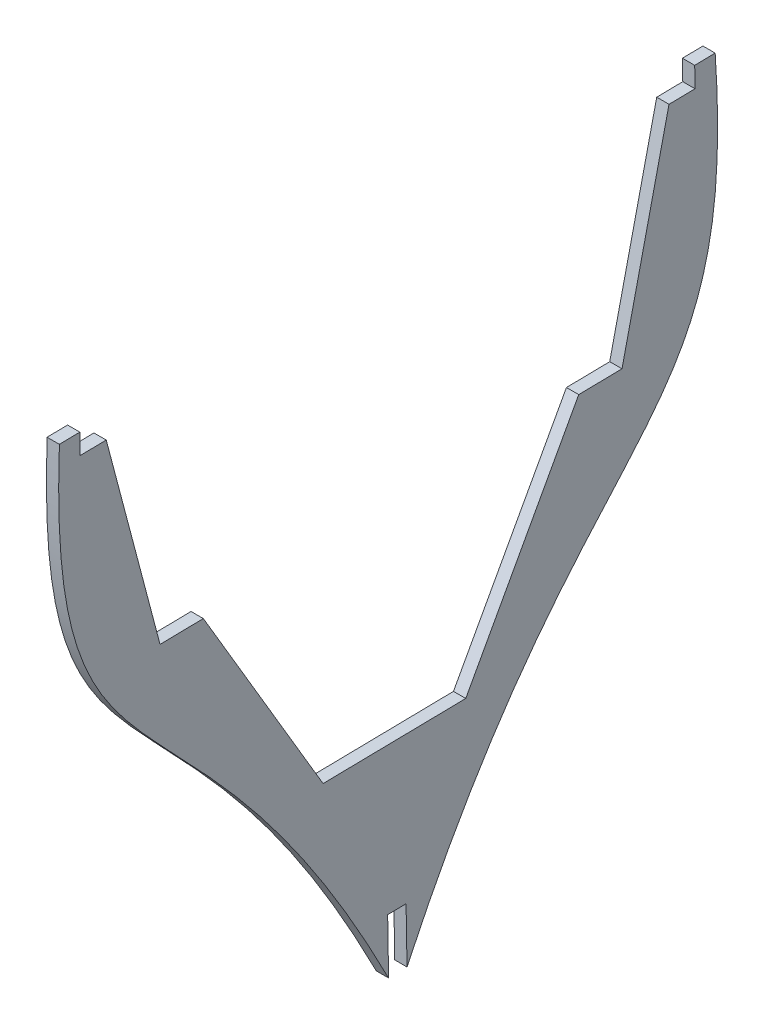
from build123d import *

# Parameters (mm, degrees)
BOSS_EXTRU_3_DEPTH      = 6
ENL_V_MAT_EXTRU_1_DEPTH = 6


with BuildPart() as part:
    # Esquisse2 → Boss.-Extru.3 (new body)
    with BuildSketch(Plane(origin=(0, 0, 0), x_dir=(0, 0, -1), z_dir=(1, 0, 0))):
        with BuildLine():
            Line((-166.024970345, 350.659764397), (-156.024970345, 350.826098218))
            Line((-156.024970345, 350.826098218), (-155.858636524, 340.826098218))
            Line((-155.858636524, 340.826098218), (-143.142974447, 341.037602684))
            Line((-143.142974447, 341.037602684), (-116.860186269, 241.460941829))
            Line((-116.860186269, 241.460941829), (-95.722481296, 241.812533352))
            Line((-95.722481296, 241.812533352), (-37.220081968, 142.7717936))
            Line((-37.220081968, 142.7717936), (32.451250452, 143.930663493))
            Line((32.451250452, 143.930663493), (87.627433462, 244.862262541))
            Line((87.627433462, 244.862262541), (108.765138435, 245.213854064))
            Line((108.765138435, 245.213854064), (131.721710294, 345.609532008))
            Line((131.721710294, 345.609532008), (144.437372371, 345.821036474))
            Line((144.437372371, 345.821036474), (144.27103855, 355.821036474))
            Line((144.27103855, 355.821036474), (154.27103855, 355.987370295))
            add(Edge.make_bspline(
                [(154.27103855, 355.987370295), (165.809052725, 188.033695436), (92.740818318, 240.498916664), (-0.586889825, 35.283853957)],
                knots=[0, 0, 0, 0, 1, 1, 1, 1], degree=3))
            add(Edge.make_bspline(
                [(-166.024970345, 350.659764397), (-171.97087196, 182.415272886), (-100.687923251, 237.281542498), (-0.586889825, 35.283853957)],
                knots=[0, 0, 0, 0, 1, 1, 1, 1], degree=3))
        make_face()
    extrude(amount=BOSS_EXTRU_3_DEPTH)

    # Esquisse3 → Enlèv. mat.-Extru.1 (cut)
    with BuildSketch(Plane(origin=(6, 0, 0), x_dir=(0, 0, -1), z_dir=(1, 0, 0))):
        Polygon((-5.242016699, 44.535241388), (-5.691118015, 71.535241388), (3.308881985, 71.684941826), (3.757983301, 44.684941826), (35.292020924, 1.197065852), (-5.781333041, 1.197065852), align=None)
    extrude(amount=-ENL_V_MAT_EXTRU_1_DEPTH, mode=Mode.SUBTRACT)


solid = part.part
